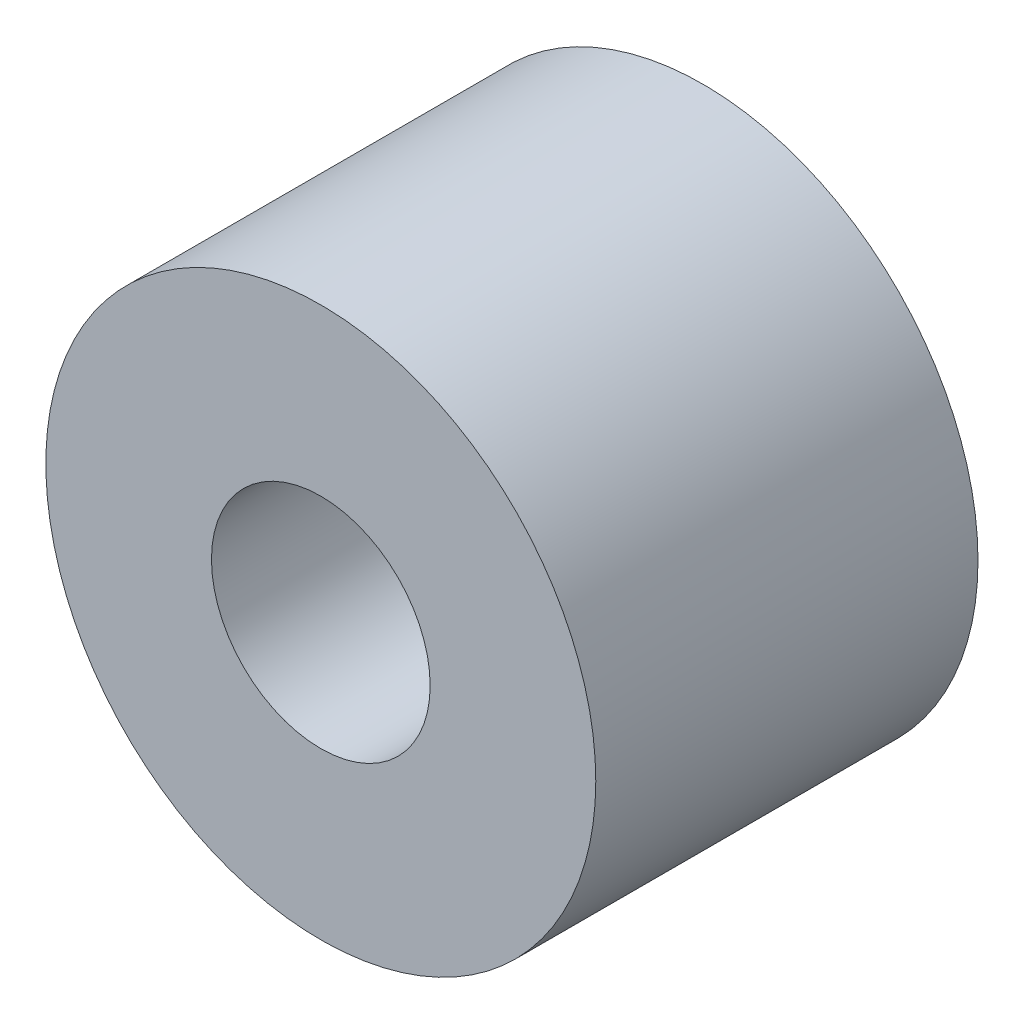
from build123d import *

# Parameters (mm, degrees)
SKETCH1_R           = 12.95
SKETCH1_R_2         = 5.15
BOSS_EXTRUDE1_DEPTH = 18


with BuildPart() as part:
    # Sketch1 → Boss-Extrude1 (new body)
    with BuildSketch(Plane.XY):
        Circle(SKETCH1_R)
        Circle(SKETCH1_R_2, mode=Mode.SUBTRACT)
    extrude(amount=BOSS_EXTRUDE1_DEPTH)


solid = part.part
